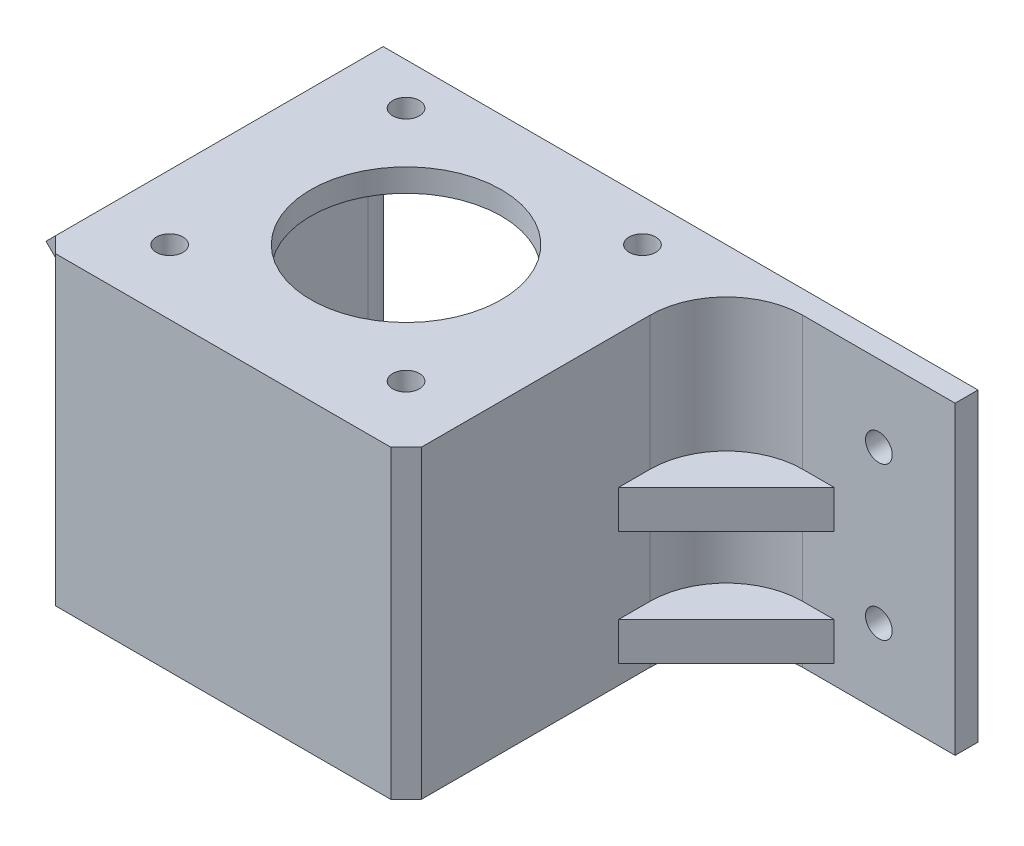
from build123d import *

# Parameters (mm, degrees)
SKETCH1_W               = 48
SKETCH1_H               = 45
BOSS_EXTRUDE1_DEPTH     = 3
BOSS_EXTRUDE2_DEPTH     = 37
SKETCH3_W               = 3
SKETCH3_H               = 40
BOSS_EXTRUDE3_DEPTH     = 30
BOSS_EXTRUDE4_DEPTH     = 3
FILLET1_R               = 10
FILLET2_R               = 5
CHAMFER1_SIZE           = 2
SKETCH5_R               = 1.75
SKETCH5_R_2             = 12.5
CUT_EXTRUDE1_DEPTH      = 91.65064234
RIB2_REACH              = 82.792
SKETCH6_WALL_W          = 183.583291708
SKETCH6_WALL_H          = 5
LPATTERN2_COUNT         = 2
LPATTERN2_PITCH         = 15
MIRROR1_COPY_1_REACH    = 82.792
MIRROR1_COPY_1_SKETCH_W = 183.583291708
MIRROR1_COPY_1_SKETCH_H = 5
SKETCH7_R               = 1.75
CUT_EXTRUDE2_DEPTH      = 97.982157929


with BuildPart() as part:
    # Sketch1 → Boss-Extrude1 (new body)
    with BuildSketch(Plane(origin=(0, 0, 0), x_dir=(1, 0, 0), z_dir=(0, 1, 0))):
        with Locations((0, -1.5)):
            Rectangle(SKETCH1_W, SKETCH1_H)
    extrude(amount=BOSS_EXTRUDE1_DEPTH)

    # Sketch2 → Boss-Extrude2 (add)
    with BuildSketch(Plane.XZ):
        Polygon((-21, 21), (21, 21), (21, -21), (24, -21), (24, 24), (-24, 24), (-24, -21), (-21, -21), align=None)
    extrude(amount=BOSS_EXTRUDE2_DEPTH)

    # Sketch3 → Boss-Extrude3 (add)
    with BuildSketch(Plane(origin=(24, 0, 0), x_dir=(0, 0, -1), z_dir=(1, 0, 0))):
        with Locations((19.5, -17)):
            Rectangle(SKETCH3_W, SKETCH3_H)
    extrude(amount=BOSS_EXTRUDE3_DEPTH)

    # Sketch4 → Boss-Extrude4 (add)
    with BuildSketch(Plane(origin=(0, 0, -21), x_dir=(-1, 0, 0), z_dir=(0, 0, -1))):
        Polygon((24, 3), (65.213203436, -38.213203436), (45.213203436, -58.213203436), (24, -37), align=None)
    extrude(amount=-BOSS_EXTRUDE4_DEPTH)

    # Fillet1
    fillet1_edges = [part.edges().sort_by_distance(p)[0] for p in [
        (24, -17, -18),
        (-24, -17, -18),
    ]]
    fillet(fillet1_edges, radius=FILLET1_R)

    # Fillet2
    fillet2_edges = [part.edges().sort_by_distance(p)[0] for p in [
        (21, -18.5, -21),
        (-21, -18.5, -21),
    ]]
    fillet(fillet2_edges, radius=FILLET2_R)

    # Chamfer1
    chamfer1_edges = [part.edges().sort_by_distance(p)[0] for p in [
        (24, -17, 24),
        (-24, -17, 24),
    ]]
    chamfer(chamfer1_edges, length=CHAMFER1_SIZE)

    # Sketch5 → Cut-Extrude1 (cut, through all)
    with BuildSketch(Plane.XZ):
        with Locations(Location((-15.5, 15.5, 0), (0, 0, 270))):
            Circle(SKETCH5_R)
        with Locations(Location((15.5, 15.5, 0), (0, 0, 270))):
            Circle(SKETCH5_R)
        with Locations(Location((15.5, -15.5, 0), (0, 0, 270))):
            Circle(SKETCH5_R)
        with Locations(Location((-15.5, -15.5, 0), (0, 0, 270))):
            Circle(SKETCH5_R)
        with Locations(Location((0, 0, 0), (0, 0, 270))):
            Circle(SKETCH5_R_2)
    extrude(amount=-CUT_EXTRUDE1_DEPTH, mode=Mode.SUBTRACT)

    # Sketch6 wall → Rib2 (add, up to next)
    with BuildSketch(Plane(origin=(-31.071067812, -17, -10.928932188), x_dir=(-0.707106781187, 0, -0.707106781187), z_dir=(-0.707106781187, 0, 0.707106781187)), mode=Mode.PRIVATE) as rib2_sk1:
        Rectangle(SKETCH6_WALL_W, SKETCH6_WALL_H)
    rib2_tool1 = extrude(rib2_sk1.sketch, amount=-RIB2_REACH, mode=Mode.PRIVATE) - part.part
    rib2 = rib2_tool1.solids().sort_by_distance((-31.071067812, -17, -10.928932188))[0]
    add(rib2)

    # LPattern2: Rib2 ×2
    with Locations(*[(0, -i * LPATTERN2_PITCH, 0) for i in range(1, LPATTERN2_COUNT)]):
        add(rib2)

    # Mirror1: Rib2 across plane
    add(rib2.mirror(Plane(origin=(0, 0, 0), x_dir=(0, 0, 1), z_dir=(1, 0, 0))))

    # Mirror1 copy 1 sketch → Mirror1 copy 1 (add, up to next)
    with BuildSketch(Plane(origin=(31.071067812, -32, -10.928932188), x_dir=(0.707106781187, 0, -0.707106781187), z_dir=(0.707106781187, 0, 0.707106781187)), mode=Mode.PRIVATE) as mirror1_copy_1_sk1:
        Rectangle(MIRROR1_COPY_1_SKETCH_W, MIRROR1_COPY_1_SKETCH_H)
    mirror1_copy_1_tool1 = extrude(mirror1_copy_1_sk1.sketch, amount=-MIRROR1_COPY_1_REACH, mode=Mode.PRIVATE) - part.part
    add(mirror1_copy_1_tool1.solids().sort_by_distance((31.071067812, -32, -10.928932188))[0])

    # Sketch7 → Cut-Extrude2 (cut, through all)
    with BuildSketch(Plane.XY.offset(-18)):
        with Locations((44, -7)):
            Circle(SKETCH7_R)
        with Locations((44, -27)):
            Circle(SKETCH7_R)
        with Locations((-50.338834765, -37.480970389)):
            Circle(SKETCH7_R)
    extrude(amount=-CUT_EXTRUDE2_DEPTH, mode=Mode.SUBTRACT)


solid = part.part
